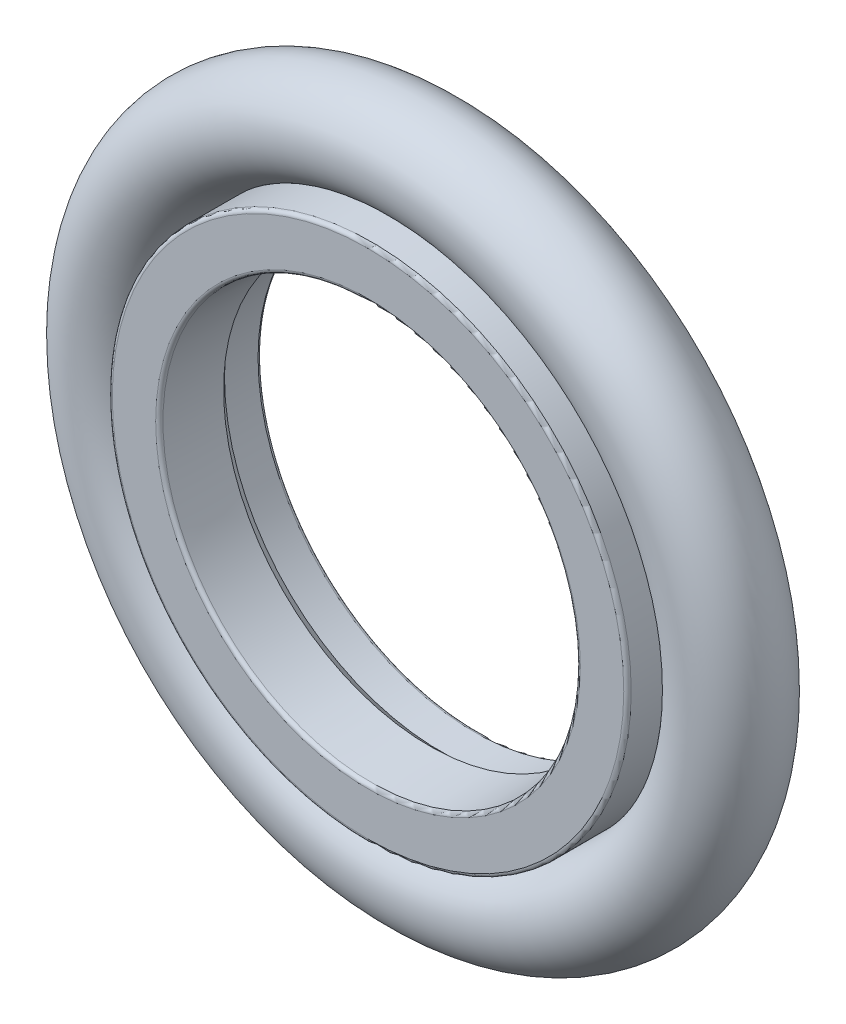
from build123d import *

# Parameters (mm, degrees)
SKETCH2_R = 1.3


with BuildPart() as part:
    # Sketch1 → Revolve1 (revolve)
    with BuildSketch(Plane(origin=(0, 0, 0), x_dir=(0, 0, -1), z_dir=(1, 0, 0)), mode=Mode.PRIVATE) as revolve1_sk:
        with BuildLine():
            Line((0.1, 6.96), (2.85, 6.96))
            ThreePointArc((2.85, 6.96), (2.920710678, 6.930710678), (2.95, 6.86))
            Line((2.95, 6.86), (2.95, 5.9))
            ThreePointArc((2.95, 5.9), (2.920710678, 5.829289322), (2.85, 5.8))
            Line((2.85, 5.8), (1.95, 5.8))
            Line((1.95, 5.8), (1.65, 5.525))
            Line((1.65, 5.525), (0.095459234, 5.595660944))
            ThreePointArc((0.095459234, 5.595660944), (0.027701741, 5.626471173), (0, 5.695557798))
            Line((0, 5.695557798), (0, 6.86))
            ThreePointArc((0, 6.86), (0.029289322, 6.930710678), (0.1, 6.96))
        make_face()
    revolve(revolve1_sk.sketch.rotate(Axis((0, 0, 0), (0, 0, -1)), 90), axis=Axis((0, 0, 0), (0, 0, -1)))


with BuildPart() as body_2:
    # Sketch2 → Revolve2 (revolve)
    with BuildSketch(Plane(origin=(0, 0, 0), x_dir=(0, 0, -1), z_dir=(1, 0, 0)), mode=Mode.PRIVATE) as revolve2_sk:
        with Locations((1.475, 8.26)):
            Circle(SKETCH2_R)
    revolve(revolve2_sk.sketch.rotate(Axis((0, 0, 0), (0, 0, -1)), 270), axis=Axis((0, 0, 0), (0, 0, -1)))


solid = Compound([part.part, body_2.part])
